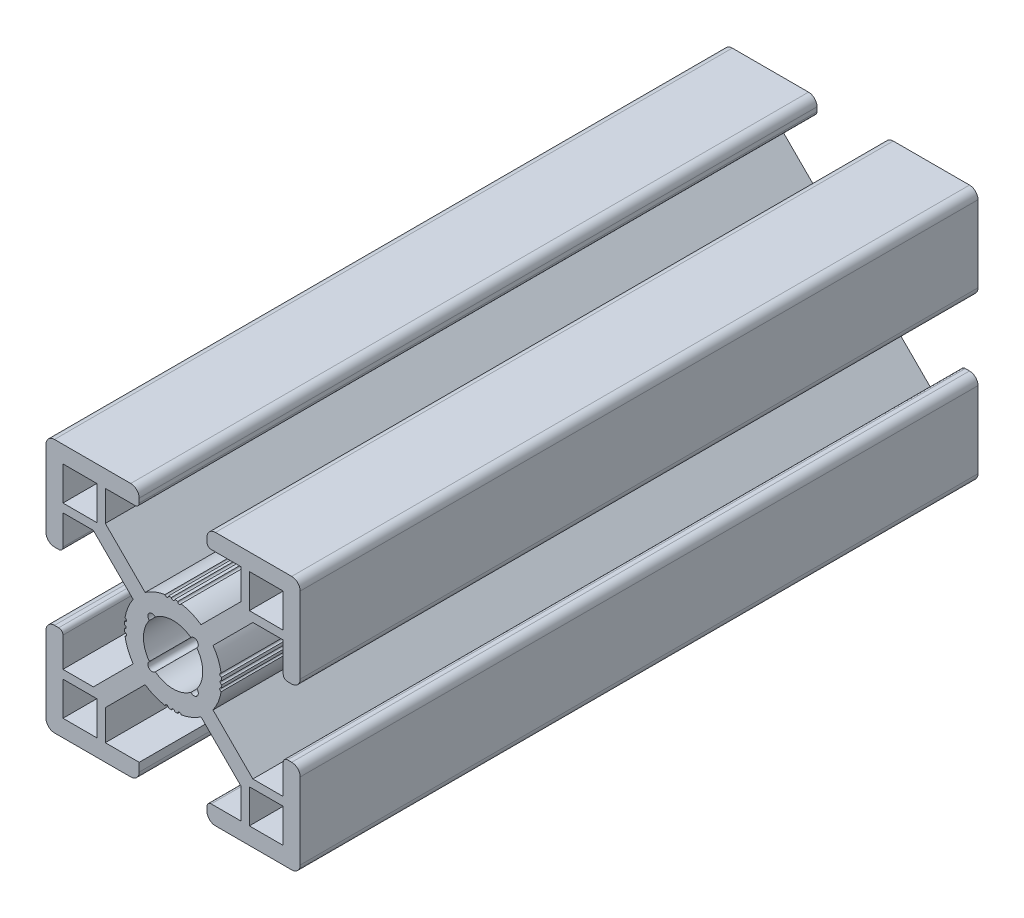
from build123d import *

# Parameters (mm, degrees)
SKETCH1_W           = 4
SKETCH1_H           = 4
BOSS_EXTRUDE1_DEPTH = 40


with BuildPart() as part:
    # Sketch1 → Boss-Extrude1 (new, symmetric)
    with BuildSketch(Plane.XY):
        with BuildLine():
            Line((-15, 14), (-15, 5))
            ThreePointArc((-15, 5), (-14.707106781, 4.292893219), (-14, 4))
            Line((-14, 4), (-13.5, 4))
            ThreePointArc((-13.5, 4), (-13.146446609, 4.146446609), (-13, 4.5))
            Line((-13, 4.5), (-13, 8))
            Line((-13, 8), (-9.414213562, 8))
            Line((-9.414213562, 8), (-4.711011126, 3.296797563))
            ThreePointArc((-4.711011126, 3.296797563), (-5.322383956, 2.17594325), (-5.671345569, 0.947807702))
            ThreePointArc((-5.671345569, 0.947807702), (-5.502585747, 0.723913043), (-5.723511591, 0.551284925))
            ThreePointArc((-5.723511591, 0.551284925), (-5.737706139, 0.375803491), (-5.746521739, 0.199969752))
            ThreePointArc((-5.746521739, 0.199969752), (-5.607354194, 0.140186212), (-5.55, 0))
            ThreePointArc((-5.55, 0), (-5.607354194, -0.140186212), (-5.746521739, -0.199969752))
            ThreePointArc((-5.746521739, -0.199969752), (-5.737706139, -0.375803491), (-5.723511591, -0.551284925))
            ThreePointArc((-5.723511591, -0.551284925), (-5.502585747, -0.723913043), (-5.671345569, -0.947807702))
            ThreePointArc((-5.671345569, -0.947807702), (-5.322383956, -2.17594325), (-4.711011126, -3.296797563))
            Line((-4.711011126, -3.296797563), (-9.414213562, -8))
            Line((-9.414213562, -8), (-13, -8))
            Line((-13, -8), (-13, -4.5))
            ThreePointArc((-13, -4.5), (-13.146446609, -4.146446609), (-13.5, -4))
            Line((-13.5, -4), (-14, -4))
            ThreePointArc((-14, -4), (-14.707106781, -4.292893219), (-15, -5))
            Line((-15, -5), (-15, -14))
            ThreePointArc((-15, -14), (-14.707106781, -14.707106781), (-14, -15))
            Line((-14, -15), (-5, -15))
            ThreePointArc((-5, -15), (-4.292893219, -14.707106781), (-4, -14))
            Line((-4, -14), (-4, -13))
            Line((-4, -13), (-8, -13))
            Line((-8, -13), (-8, -9.414213562))
            Line((-8, -9.414213562), (-3.296797563, -4.711011126))
            ThreePointArc((-3.296797563, -4.711011126), (-2.17594325, -5.322383956), (-0.947807702, -5.671345569))
            ThreePointArc((-0.947807702, -5.671345569), (-0.723913043, -5.502585747), (-0.551284925, -5.723511591))
            ThreePointArc((-0.551284925, -5.723511591), (-0.375803491, -5.737706139), (-0.199969752, -5.746521739))
            ThreePointArc((-0.199969752, -5.746521739), (-0.140186212, -5.607354194), (0, -5.55))
            ThreePointArc((0, -5.55), (0.140186212, -5.607354194), (0.199969752, -5.746521739))
            ThreePointArc((0.199969752, -5.746521739), (0.375803491, -5.737706139), (0.551284925, -5.723511591))
            ThreePointArc((0.551284925, -5.723511591), (0.723913043, -5.502585747), (0.947807702, -5.671345569))
            ThreePointArc((0.947807702, -5.671345569), (2.17594325, -5.322383956), (3.296797563, -4.711011126))
            Line((3.296797563, -4.711011126), (8, -9.414213562))
            Line((8, -9.414213562), (8, -13))
            Line((8, -13), (4.5, -13))
            ThreePointArc((4.5, -13), (4.146446609, -13.146446609), (4, -13.5))
            Line((4, -13.5), (4, -14))
            ThreePointArc((4, -14), (4.292893219, -14.707106781), (5, -15))
            Line((5, -15), (14, -15))
            ThreePointArc((14, -15), (14.707106781, -14.707106781), (15, -14))
            Line((15, -14), (15, -5))
            ThreePointArc((15, -5), (14.707106781, -4.292893219), (14, -4))
            Line((14, -4), (13.5, -4))
            ThreePointArc((13.5, -4), (13.146446609, -4.146446609), (13, -4.5))
            Line((13, -4.5), (13, -8))
            Line((13, -8), (9.414213562, -8))
            Line((9.414213562, -8), (4.711011126, -3.296797563))
            ThreePointArc((4.711011126, -3.296797563), (5.322383956, -2.17594325), (5.671345569, -0.947807702))
            ThreePointArc((5.671345569, -0.947807702), (5.502585747, -0.723913043), (5.723511591, -0.551284925))
            ThreePointArc((5.723511591, -0.551284925), (5.737706139, -0.375803491), (5.746521739, -0.199969752))
            ThreePointArc((5.746521739, -0.199969752), (5.607354194, -0.140186212), (5.55, 0))
            ThreePointArc((5.55, 0), (5.607354194, 0.140186212), (5.746521739, 0.199969752))
            ThreePointArc((5.746521739, 0.199969752), (5.737706139, 0.375803491), (5.723511591, 0.551284925))
            ThreePointArc((5.723511591, 0.551284925), (5.502585747, 0.723913043), (5.671345569, 0.947807702))
            ThreePointArc((5.671345569, 0.947807702), (5.322383956, 2.17594325), (4.711011126, 3.296797563))
            Line((4.711011126, 3.296797563), (9.414213562, 8))
            Line((9.414213562, 8), (13, 8))
            Line((13, 8), (13, 4.5))
            ThreePointArc((13, 4.5), (13.146446609, 4.146446609), (13.5, 4))
            Line((13.5, 4), (14, 4))
            ThreePointArc((14, 4), (14.707106781, 4.292893219), (15, 5))
            Line((15, 5), (15, 14))
            ThreePointArc((15, 14), (14.707106781, 14.707106781), (14, 15))
            Line((14, 15), (5, 15))
            ThreePointArc((5, 15), (4.292893219, 14.707106781), (4, 14))
            Line((4, 14), (4, 13.5))
            ThreePointArc((4, 13.5), (4.146446609, 13.146446609), (4.5, 13))
            Line((4.5, 13), (8, 13))
            Line((8, 13), (8, 9.414213562))
            Line((8, 9.414213562), (3.296797563, 4.711011126))
            ThreePointArc((3.296797563, 4.711011126), (2.17594325, 5.322383956), (0.947807702, 5.671345569))
            ThreePointArc((0.947807702, 5.671345569), (0.723913043, 5.502585747), (0.551284925, 5.723511591))
            ThreePointArc((0.551284925, 5.723511591), (0.375803491, 5.737706139), (0.199969752, 5.746521739))
            ThreePointArc((0.199969752, 5.746521739), (0.140186212, 5.607354194), (0, 5.55))
            ThreePointArc((0, 5.55), (-0.140186212, 5.607354194), (-0.199969752, 5.746521739))
            ThreePointArc((-0.199969752, 5.746521739), (-0.375803491, 5.737706139), (-0.551284925, 5.723511591))
            ThreePointArc((-0.551284925, 5.723511591), (-0.723913043, 5.502585747), (-0.947807702, 5.671345569))
            ThreePointArc((-0.947807702, 5.671345569), (-2.17594325, 5.322383956), (-3.296797563, 4.711011126))
            Line((-3.296797563, 4.711011126), (-8, 9.414213562))
            Line((-8, 9.414213562), (-8, 13))
            Line((-8, 13), (-4.5, 13))
            ThreePointArc((-4.5, 13), (-4.146446609, 13.146446609), (-4, 13.5))
            Line((-4, 13.5), (-4, 14))
            ThreePointArc((-4, 14), (-4.292893219, 14.707106781), (-5, 15))
            Line((-5, 15), (-14, 15))
            ThreePointArc((-14, 15), (-14.707106781, 14.707106781), (-15, 14))
        make_face()
        with Locations((-11, -11)):
            Rectangle(SKETCH1_W, SKETCH1_H, mode=Mode.SUBTRACT)
        with Locations((11, -11)):
            Rectangle(SKETCH1_W, SKETCH1_H, mode=Mode.SUBTRACT)
        with BuildLine():
            ThreePointArc((-2.096969605, 2.802270236), (-1.105000944, 3.320989749), (0, 3.5))
            ThreePointArc((0, 3.5), (1.105000944, 3.320989749), (2.096969605, 2.802270236))
            ThreePointArc((2.096969605, 2.802270236), (2.828427125, 2.828427125), (2.802270236, 2.096969605))
            ThreePointArc((2.802270236, 2.096969605), (3.320989749, 1.105000944), (3.5, 0))
            ThreePointArc((3.5, 0), (3.320989749, -1.105000944), (2.802270236, -2.096969605))
            ThreePointArc((2.802270236, -2.096969605), (2.828427125, -2.828427125), (2.096969605, -2.802270236))
            ThreePointArc((2.096969605, -2.802270236), (1.105000944, -3.320989749), (0, -3.5))
            ThreePointArc((0, -3.5), (-1.105000944, -3.320989749), (-2.096969605, -2.802270236))
            ThreePointArc((-2.096969605, -2.802270236), (-2.828427125, -2.828427125), (-2.802270236, -2.096969605))
            ThreePointArc((-2.802270236, -2.096969605), (-3.320989749, -1.105000944), (-3.5, 0))
            ThreePointArc((-3.5, 0), (-3.320989749, 1.105000944), (-2.802270236, 2.096969605))
            ThreePointArc((-2.802270236, 2.096969605), (-2.828427125, 2.828427125), (-2.096969605, 2.802270236))
        make_face(mode=Mode.SUBTRACT)
        with Locations((-11, 11)):
            Rectangle(SKETCH1_W, SKETCH1_H, mode=Mode.SUBTRACT)
        with Locations((11, 11)):
            Rectangle(SKETCH1_W, SKETCH1_H, mode=Mode.SUBTRACT)
    extrude(amount=BOSS_EXTRUDE1_DEPTH, both=True)


solid = part.part
